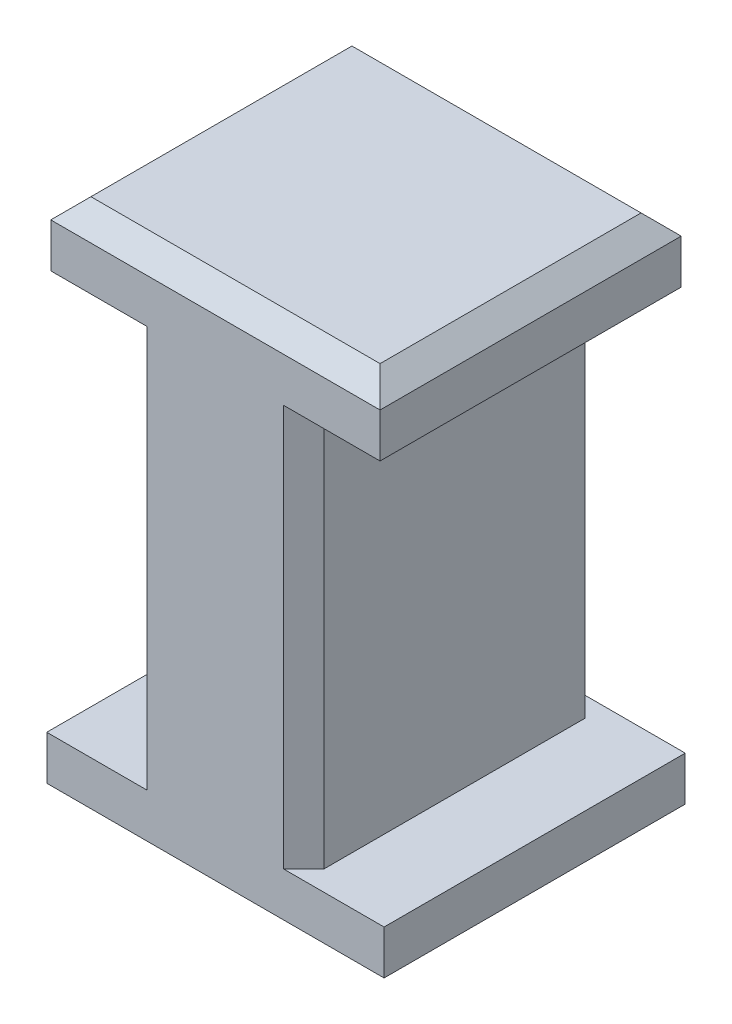
from build123d import *

# Parameters (mm, degrees)
EXTRUDE_1_DEPTH = 15
CHAMFER_1_SIZE  = 1


with BuildPart() as part:
    # 스케치1 → 보스-돌출1 (new body)
    with BuildSketch(Plane.XY):
        Polygon((-8.4, 0), (8.4, 0), (8.4, 3.2), (4.4, 3.2), (4.4, 23.2), (8.2, 23.2), (8.2, 26.4), (-8.2, 26.4), (-8.2, 23.2), (-4.4, 23.2), (-4.4, 3.2), (-8.4, 3.2), align=None)
    extrude(amount=EXTRUDE_1_DEPTH)

    # 모따기1
    chamfer_1_edges = [part.edges().sort_by_distance(p)[0] for p in [
        (4.4, 13.2, 0),
        (0, 0, 0),
        (-4.4, 13.2, 0),
        (0, 26.4, 0),
        (-4.4, 13.2, 15),
        (8.4, 0, 7.5),
        (-8.4, 0, 7.5),
        (-8.2, 26.4, 7.5),
        (8.2, 26.4, 7.5),
        (0, 0, 15),
        (4.4, 13.2, 15),
        (0, 26.4, 15),
    ]]
    chamfer(chamfer_1_edges, length=CHAMFER_1_SIZE)


solid = part.part
